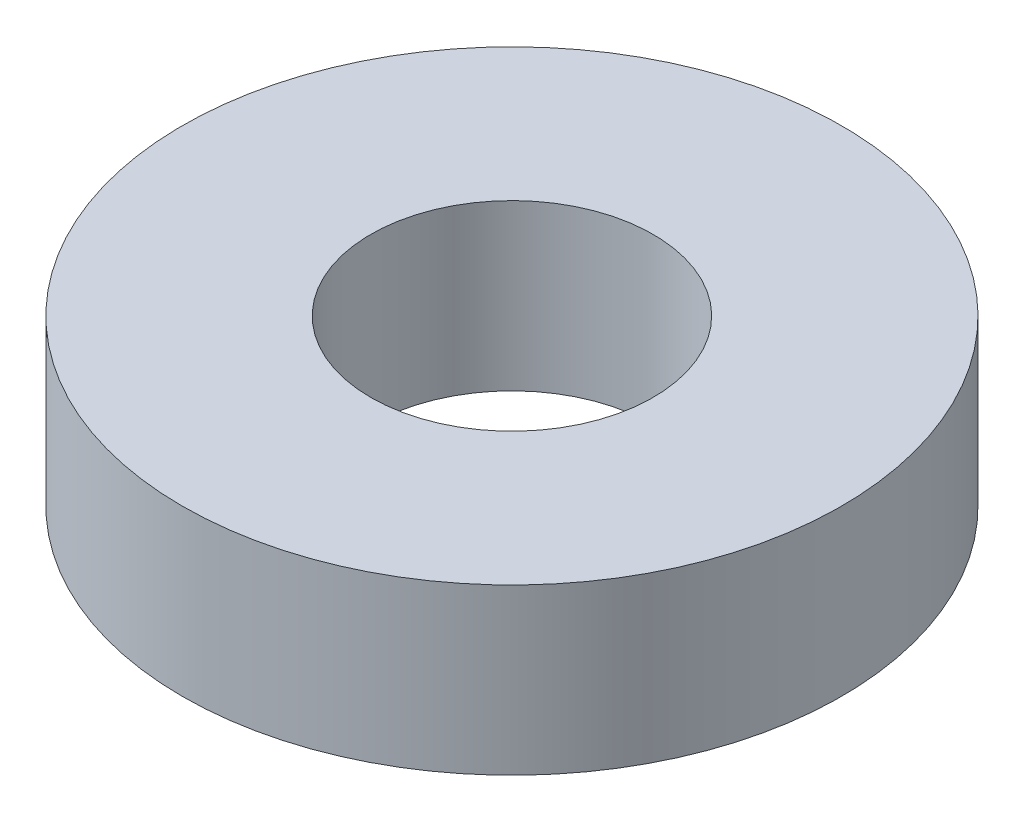
from build123d import *

# Parameters (mm, degrees)
SKETCH_1_R      = 14
SKETCH_1_R_2    = 6
EXTRUDE_1_DEPTH = 7


with BuildPart() as part:
    # 草图1 → 凸台-拉伸1 (new body)
    with BuildSketch(Plane(origin=(0, 0, 0), x_dir=(1, 0, 0), z_dir=(0, 1, 0))):
        with Locations(Location((0, 0, 0), (0, 0, 270))):
            Circle(SKETCH_1_R)
        with Locations(Location((0, 0, 0), (0, 0, 270))):
            Circle(SKETCH_1_R_2, mode=Mode.SUBTRACT)
    extrude(amount=EXTRUDE_1_DEPTH)


solid = part.part
